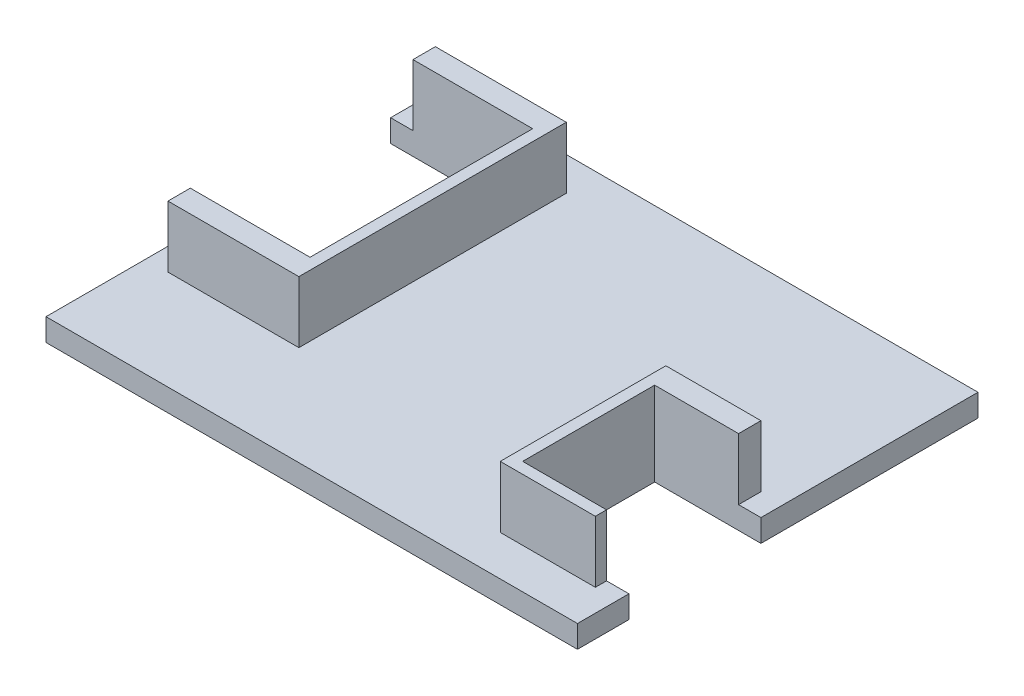
from build123d import *

# Parameters (mm, degrees)
ESQUISSE1_W             = 47.5
ESQUISSE1_H             = 35.8
BOSS_EXTRU_1_DEPTH      = 2
ESQUISSE2_W             = 9.5
ESQUISSE2_H             = 11.8
ENL_V_MAT_EXTRU_1_DEPTH = 10
ESQUISSE3_W             = 12.7
ESQUISSE3_H             = 19.9
ENL_V_MAT_EXTRU_2_DEPTH = 10
ESQUISSE5_W             = 1
ESQUISSE5_H             = 11.8
BOSS_EXTRU_2_DEPTH      = 5.5
ESQUISSE6_W             = 8.5
ESQUISSE6_H             = 1
BOSS_EXTRU_3_DEPTH      = 5.5
ESQUISSE7_W             = 8.5
ESQUISSE7_H             = 2
BOSS_EXTRU_4_DEPTH      = 5.5
ESQUISSE8_W             = 10.7
ESQUISSE8_H             = 2
BOSS_EXTRU_5_DEPTH      = 5.5
ESQUISSE9_W             = 1
ESQUISSE9_H             = 21.9
BOSS_EXTRU_6_DEPTH      = 5.5
ESQUISSE11_W            = 11.7
ESQUISSE11_H            = 2
BOSS_EXTRU_7_DEPTH      = 5.5


with BuildPart() as part:
    # Esquisse1 → Boss.-Extru.1 (new body)
    with BuildSketch(Plane(origin=(0, 0, 0), x_dir=(1, 0, 0), z_dir=(0, 1, 0))):
        with Locations((23.75, 17.9)):
            Rectangle(ESQUISSE1_W, ESQUISSE1_H)
    extrude(amount=BOSS_EXTRU_1_DEPTH)

    # Esquisse2 → Enlèv. mat.-Extru.1 (cut)
    with BuildSketch(Plane(origin=(0, 2, 0), x_dir=(1, 0, 0), z_dir=(0, 1, 0))):
        with Locations((42.75, 10.5)):
            Rectangle(ESQUISSE2_W, ESQUISSE2_H)
    extrude(amount=-ENL_V_MAT_EXTRU_1_DEPTH, mode=Mode.SUBTRACT)

    # Esquisse3 → Enlèv. mat.-Extru.2 (cut)
    with BuildSketch(Plane(origin=(0, 2, 0), x_dir=(1, 0, 0), z_dir=(0, 1, 0))):
        with Locations((6.35, 20.85)):
            Rectangle(ESQUISSE3_W, ESQUISSE3_H)
    extrude(amount=-ENL_V_MAT_EXTRU_2_DEPTH, mode=Mode.SUBTRACT)

    # Esquisse5 → Boss.-Extru.2 (add)
    with BuildSketch(Plane(origin=(0, 2, 0), x_dir=(1, 0, 0), z_dir=(0, 1, 0))):
        with Locations((37.5, 10.5)):
            Rectangle(ESQUISSE5_W, ESQUISSE5_H)
    extrude(amount=BOSS_EXTRU_2_DEPTH)

    # Esquisse6 → Boss.-Extru.3 (add)
    with BuildSketch(Plane(origin=(0, 2, 0), x_dir=(1, 0, 0), z_dir=(0, 1, 0))):
        with Locations((41.25, 4.1)):
            Rectangle(ESQUISSE6_W, ESQUISSE6_H)
    extrude(amount=BOSS_EXTRU_3_DEPTH)

    # Esquisse7 → Boss.-Extru.4 (add)
    with BuildSketch(Plane(origin=(0, 2, 0), x_dir=(1, 0, 0), z_dir=(0, 1, 0))):
        with Locations((41.25, 17.4)):
            Rectangle(ESQUISSE7_W, ESQUISSE7_H)
    extrude(amount=BOSS_EXTRU_4_DEPTH)

    # Esquisse8 → Boss.-Extru.5 (add)
    with BuildSketch(Plane(origin=(0, 2, 0), x_dir=(1, 0, 0), z_dir=(0, 1, 0))):
        with Locations((7.35, 31.8)):
            Rectangle(ESQUISSE8_W, ESQUISSE8_H)
    extrude(amount=BOSS_EXTRU_5_DEPTH)

    # Esquisse9 → Boss.-Extru.6 (add)
    with BuildSketch(Plane(origin=(0, 2, 0), x_dir=(1, 0, 0), z_dir=(0, 1, 0))):
        with Locations((13.2, 21.85)):
            Rectangle(ESQUISSE9_W, ESQUISSE9_H)
    extrude(amount=BOSS_EXTRU_6_DEPTH)

    # Esquisse11 → Boss.-Extru.7 (add)
    with BuildSketch(Plane(origin=(0, 2, 0), x_dir=(1, 0, 0), z_dir=(0, 1, 0))):
        with Locations((7.85, 9.9)):
            Rectangle(ESQUISSE11_W, ESQUISSE11_H)
    extrude(amount=BOSS_EXTRU_7_DEPTH)


solid = part.part
